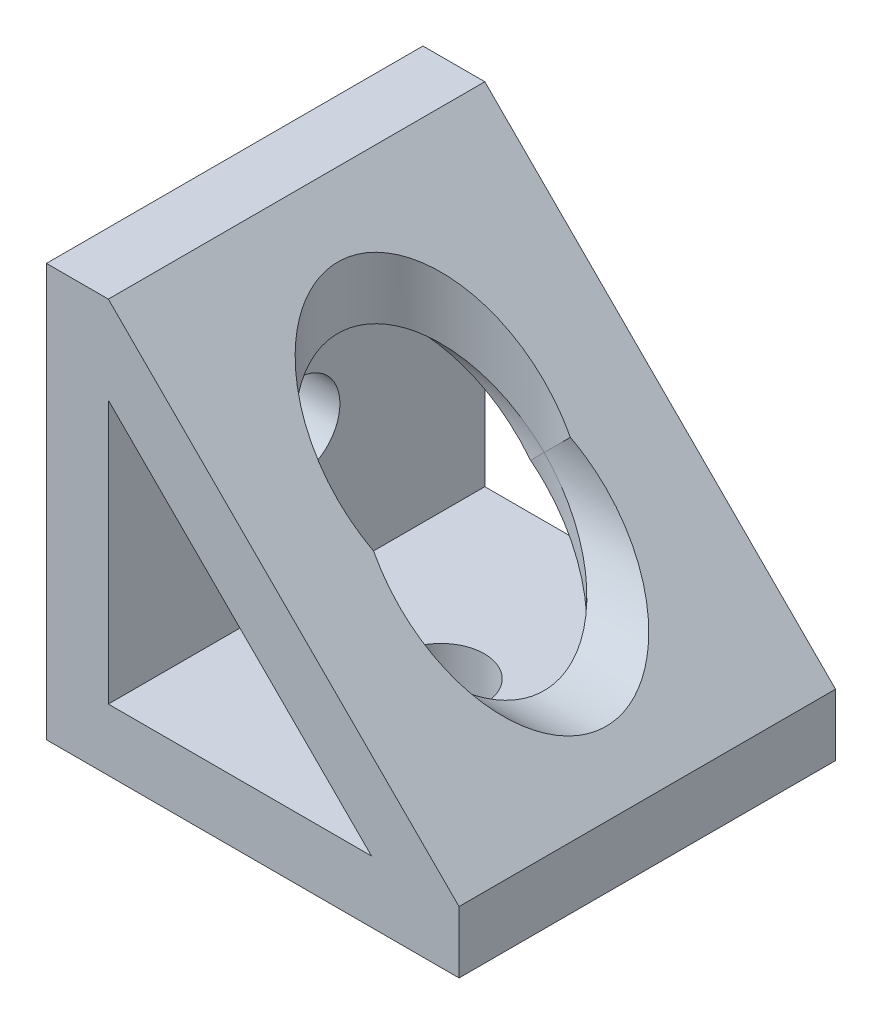
from build123d import *

# Parameters (mm, degrees)
BOSS_EXTRUDE1_DEPTH      = 18.25
BOSS_EXTRUDE1_DEPTH_BACK = 18.25
CUT_EXTRUDE1_REACH       = 50.302
SKETCH4_R                = 4.2
SKETCH6_R                = 10
CUT_EXTRUDE2_DEPTH       = 44.463346627


with BuildPart() as part:
    # Sketch2 → Boss-Extrude1 (new, two sides: drawn at the far end of the back side and taken through both)
    with BuildSketch(Plane.XY.offset(-BOSS_EXTRUDE1_DEPTH_BACK)):
        Polygon((-20, 20), (-20, -20), (20, -20), (20, -14), (-14, 20), align=None)
        Polygon((-14, 11.514718626), (-14, -14), (11.514718626, -14), align=None, mode=Mode.SUBTRACT)
    extrude(amount=BOSS_EXTRUDE1_DEPTH + BOSS_EXTRUDE1_DEPTH_BACK)

    # Sketch4 → Cut-Extrude1 (cut, up to next)
    with BuildSketch(Plane.XZ.offset(20), mode=Mode.PRIVATE) as cut_extrude1_sk1:
        with Locations(Location((0, 0, 0), (0, 0, 270))):
            Circle(SKETCH4_R)
    cut_extrude1_tool1 = extrude(cut_extrude1_sk1.sketch, amount=-CUT_EXTRUDE1_REACH, mode=Mode.PRIVATE) & part.part
    cut_extrude1 = cut_extrude1_tool1.solids().sort_by_distance((0, -20, 0))[0]
    add(cut_extrude1, mode=Mode.SUBTRACT)

    # Sketch6 → Cut-Extrude2 (cut, through all)
    with BuildSketch(Plane(origin=(0, -14, 0), x_dir=(1, 0, 0), z_dir=(0, 1, 0))):
        Circle(SKETCH6_R)
    cut_extrude2 = extrude(amount=CUT_EXTRUDE2_DEPTH, mode=Mode.SUBTRACT)

    # Mirror1: Cut-Extrude1, Cut-Extrude2 across plane
    add(cut_extrude1.mirror(Plane(origin=(0, 0, 0), x_dir=(0, 0, 1), z_dir=(0.7071067811865476, -0.7071067811865476, 0))), mode=Mode.SUBTRACT)
    add(cut_extrude2.mirror(Plane(origin=(0, 0, 0), x_dir=(0, 0, 1), z_dir=(0.7071067811865476, -0.7071067811865476, 0))), mode=Mode.SUBTRACT)


solid = part.part
